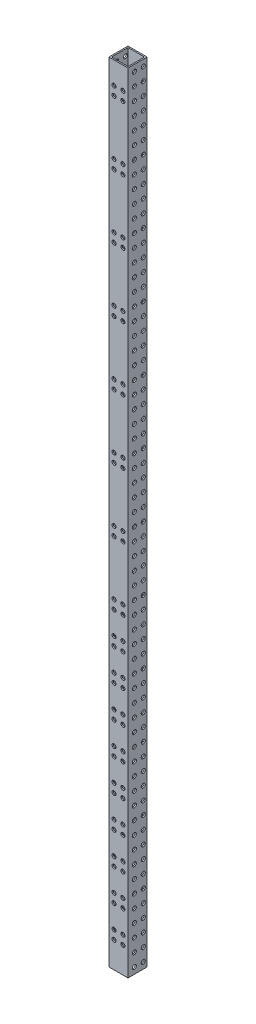
from build123d import *

# Parameters (mm, degrees)
SKETCH_1_W          = 15
SKETCH_1_H          = 15
SKETCH_1_W_2        = 13
SKETCH_1_H_2        = 13
EXTRUDE_1_DEPTH     = 620
SKETCH_3_R          = 1.6
CUT_EXTRUDE_1_DEPTH = 15
SKETCH_4_R          = 1.6
CUT_EXTRUDE_2_DEPTH = 15


with BuildPart() as part:
    # 草图1 → 凸台-拉伸1 (new body)
    with BuildSketch(Plane(origin=(0, 0, 0), x_dir=(1, 0, 0), z_dir=(0, 1, 0))):
        Rectangle(SKETCH_1_W, SKETCH_1_H)
        Rectangle(SKETCH_1_W_2, SKETCH_1_H_2, mode=Mode.SUBTRACT)
    extrude(amount=EXTRUDE_1_DEPTH)

    # 草图3 → 切除-拉伸1 (cut)
    with BuildSketch(Plane.XY.offset(7.5)):
        with Locations((3.5, 245.5)):
            Circle(SKETCH_3_R)
        with Locations((-3.5, 245.5)):
            Circle(SKETCH_3_R)
        with Locations((-3.5, 252.5)):
            Circle(SKETCH_3_R)
        with Locations((3.5, 252.5)):
            Circle(SKETCH_3_R)
        with Locations((-3.5, 302.5)):
            Circle(SKETCH_3_R)
        with Locations((-3.5, 295.5)):
            Circle(SKETCH_3_R)
        with Locations((3.5, 295.5)):
            Circle(SKETCH_3_R)
        with Locations((3.5, 302.5)):
            Circle(SKETCH_3_R)
        with Locations((-3.5, 352.5)):
            Circle(SKETCH_3_R)
        with Locations((-3.5, 345.5)):
            Circle(SKETCH_3_R)
        with Locations((3.5, 345.5)):
            Circle(SKETCH_3_R)
        with Locations((3.5, 352.5)):
            Circle(SKETCH_3_R)
        with Locations((-3.5, 402.5)):
            Circle(SKETCH_3_R)
        with Locations((-3.5, 395.5)):
            Circle(SKETCH_3_R)
        with Locations((3.5, 395.5)):
            Circle(SKETCH_3_R)
        with Locations((3.5, 402.5)):
            Circle(SKETCH_3_R)
        with Locations((-3.5, 452.5)):
            Circle(SKETCH_3_R)
        with Locations((-3.5, 445.5)):
            Circle(SKETCH_3_R)
        with Locations((3.5, 445.5)):
            Circle(SKETCH_3_R)
        with Locations((3.5, 452.5)):
            Circle(SKETCH_3_R)
        with Locations((-3.5, 502.5)):
            Circle(SKETCH_3_R)
        with Locations((-3.5, 495.5)):
            Circle(SKETCH_3_R)
        with Locations((3.5, 495.5)):
            Circle(SKETCH_3_R)
        with Locations((3.5, 502.5)):
            Circle(SKETCH_3_R)
        with Locations((-3.5, 552.5)):
            Circle(SKETCH_3_R)
        with Locations((-3.5, 545.5)):
            Circle(SKETCH_3_R)
        with Locations((3.5, 545.5)):
            Circle(SKETCH_3_R)
        with Locations((3.5, 552.5)):
            Circle(SKETCH_3_R)
        with Locations((-3.5, 602.5)):
            Circle(SKETCH_3_R)
        with Locations((-3.5, 595.5)):
            Circle(SKETCH_3_R)
        with Locations((3.5, 595.5)):
            Circle(SKETCH_3_R)
        with Locations((3.5, 602.5)):
            Circle(SKETCH_3_R)
        with Locations((-3.5, 227.5)):
            Circle(SKETCH_3_R)
        with Locations((3.5, 227.5)):
            Circle(SKETCH_3_R)
        with Locations((-3.5, 220.5)):
            Circle(SKETCH_3_R)
        with Locations((3.5, 220.5)):
            Circle(SKETCH_3_R)
        with Locations((-3.5, 202.5)):
            Circle(SKETCH_3_R)
        with Locations((3.5, 202.5)):
            Circle(SKETCH_3_R)
        with Locations((-3.5, 195.5)):
            Circle(SKETCH_3_R)
        with Locations((3.5, 195.5)):
            Circle(SKETCH_3_R)
        with Locations((-3.5, 177.5)):
            Circle(SKETCH_3_R)
        with Locations((3.5, 177.5)):
            Circle(SKETCH_3_R)
        with Locations((-3.5, 170.5)):
            Circle(SKETCH_3_R)
        with Locations((3.5, 170.5)):
            Circle(SKETCH_3_R)
        with Locations((-3.5, 152.5)):
            Circle(SKETCH_3_R)
        with Locations((3.5, 152.5)):
            Circle(SKETCH_3_R)
        with Locations((-3.5, 145.5)):
            Circle(SKETCH_3_R)
        with Locations((3.5, 145.5)):
            Circle(SKETCH_3_R)
        with Locations((-3.5, 127.5)):
            Circle(SKETCH_3_R)
        with Locations((3.5, 127.5)):
            Circle(SKETCH_3_R)
        with Locations((-3.5, 120.5)):
            Circle(SKETCH_3_R)
        with Locations((3.5, 120.5)):
            Circle(SKETCH_3_R)
        with Locations((-3.5, 102.5)):
            Circle(SKETCH_3_R)
        with Locations((3.5, 102.5)):
            Circle(SKETCH_3_R)
        with Locations((-3.5, 95.5)):
            Circle(SKETCH_3_R)
        with Locations((3.5, 95.5)):
            Circle(SKETCH_3_R)
        with Locations((-3.5, 77.5)):
            Circle(SKETCH_3_R)
        with Locations((3.5, 77.5)):
            Circle(SKETCH_3_R)
        with Locations((-3.5, 70.5)):
            Circle(SKETCH_3_R)
        with Locations((3.5, 70.5)):
            Circle(SKETCH_3_R)
        with Locations((-3.5, 52.5)):
            Circle(SKETCH_3_R)
        with Locations((3.5, 52.5)):
            Circle(SKETCH_3_R)
        with Locations((-3.5, 45.5)):
            Circle(SKETCH_3_R)
        with Locations((3.5, 45.5)):
            Circle(SKETCH_3_R)
        with Locations((-3.5, 27.5)):
            Circle(SKETCH_3_R)
        with Locations((3.5, 27.5)):
            Circle(SKETCH_3_R)
        with Locations((-3.5, 20.5)):
            Circle(SKETCH_3_R)
        with Locations((3.5, 20.5)):
            Circle(SKETCH_3_R)
    extrude(amount=-CUT_EXTRUDE_1_DEPTH, mode=Mode.SUBTRACT)

    # 草图4 → 切除-拉伸2 (cut)
    with BuildSketch(Plane.ZY.offset(7.5)):
        with Locations((2.5, 5)):
            Circle(SKETCH_4_R)
        with Locations((-4.5, 5)):
            Circle(SKETCH_4_R)
        with Locations((-4.5, 15)):
            Circle(SKETCH_4_R)
        with Locations((2.5, 15)):
            Circle(SKETCH_4_R)
        with Locations((-4.5, 25)):
            Circle(SKETCH_4_R)
        with Locations((2.5, 25)):
            Circle(SKETCH_4_R)
        with Locations((-4.5, 35)):
            Circle(SKETCH_4_R)
        with Locations((2.5, 35)):
            Circle(SKETCH_4_R)
        with Locations((-4.5, 45)):
            Circle(SKETCH_4_R)
        with Locations((2.5, 45)):
            Circle(SKETCH_4_R)
        with Locations((-4.5, 55)):
            Circle(SKETCH_4_R)
        with Locations((2.5, 55)):
            Circle(SKETCH_4_R)
        with Locations((-4.5, 65)):
            Circle(SKETCH_4_R)
        with Locations((2.5, 65)):
            Circle(SKETCH_4_R)
        with Locations((-4.5, 75)):
            Circle(SKETCH_4_R)
        with Locations((2.5, 75)):
            Circle(SKETCH_4_R)
        with Locations((-4.5, 85)):
            Circle(SKETCH_4_R)
        with Locations((2.5, 85)):
            Circle(SKETCH_4_R)
        with Locations((-4.5, 95)):
            Circle(SKETCH_4_R)
        with Locations((2.5, 95)):
            Circle(SKETCH_4_R)
        with Locations((-4.5, 105)):
            Circle(SKETCH_4_R)
        with Locations((2.5, 105)):
            Circle(SKETCH_4_R)
        with Locations((-4.5, 115)):
            Circle(SKETCH_4_R)
        with Locations((2.5, 115)):
            Circle(SKETCH_4_R)
        with Locations((-4.5, 125)):
            Circle(SKETCH_4_R)
        with Locations((2.5, 125)):
            Circle(SKETCH_4_R)
        with Locations((-4.5, 135)):
            Circle(SKETCH_4_R)
        with Locations((2.5, 135)):
            Circle(SKETCH_4_R)
        with Locations((-4.5, 145)):
            Circle(SKETCH_4_R)
        with Locations((2.5, 145)):
            Circle(SKETCH_4_R)
        with Locations((-4.5, 155)):
            Circle(SKETCH_4_R)
        with Locations((2.5, 155)):
            Circle(SKETCH_4_R)
        with Locations((-4.5, 165)):
            Circle(SKETCH_4_R)
        with Locations((2.5, 165)):
            Circle(SKETCH_4_R)
        with Locations((-4.5, 175)):
            Circle(SKETCH_4_R)
        with Locations((2.5, 175)):
            Circle(SKETCH_4_R)
        with Locations((-4.5, 185)):
            Circle(SKETCH_4_R)
        with Locations((2.5, 185)):
            Circle(SKETCH_4_R)
        with Locations((-4.5, 195)):
            Circle(SKETCH_4_R)
        with Locations((2.5, 195)):
            Circle(SKETCH_4_R)
        with Locations((-4.5, 205)):
            Circle(SKETCH_4_R)
        with Locations((2.5, 205)):
            Circle(SKETCH_4_R)
        with Locations((-4.5, 215)):
            Circle(SKETCH_4_R)
        with Locations((2.5, 215)):
            Circle(SKETCH_4_R)
        with Locations((-4.5, 225)):
            Circle(SKETCH_4_R)
        with Locations((2.5, 225)):
            Circle(SKETCH_4_R)
        with Locations((-4.5, 235)):
            Circle(SKETCH_4_R)
        with Locations((2.5, 235)):
            Circle(SKETCH_4_R)
        with Locations((-4.5, 245)):
            Circle(SKETCH_4_R)
        with Locations((2.5, 245)):
            Circle(SKETCH_4_R)
        with Locations((-4.5, 255)):
            Circle(SKETCH_4_R)
        with Locations((2.5, 255)):
            Circle(SKETCH_4_R)
        with Locations((-4.5, 265)):
            Circle(SKETCH_4_R)
        with Locations((2.5, 265)):
            Circle(SKETCH_4_R)
        with Locations((-4.5, 275)):
            Circle(SKETCH_4_R)
        with Locations((2.5, 275)):
            Circle(SKETCH_4_R)
        with Locations((-4.5, 285)):
            Circle(SKETCH_4_R)
        with Locations((2.5, 285)):
            Circle(SKETCH_4_R)
        with Locations((-4.5, 295)):
            Circle(SKETCH_4_R)
        with Locations((2.5, 295)):
            Circle(SKETCH_4_R)
        with Locations((-4.5, 305)):
            Circle(SKETCH_4_R)
        with Locations((2.5, 305)):
            Circle(SKETCH_4_R)
        with Locations((-4.5, 315)):
            Circle(SKETCH_4_R)
        with Locations((2.5, 315)):
            Circle(SKETCH_4_R)
        with Locations((-4.5, 325)):
            Circle(SKETCH_4_R)
        with Locations((2.5, 325)):
            Circle(SKETCH_4_R)
        with Locations((-4.5, 335)):
            Circle(SKETCH_4_R)
        with Locations((2.5, 335)):
            Circle(SKETCH_4_R)
        with Locations((-4.5, 345)):
            Circle(SKETCH_4_R)
        with Locations((2.5, 345)):
            Circle(SKETCH_4_R)
        with Locations((-4.5, 355)):
            Circle(SKETCH_4_R)
        with Locations((2.5, 355)):
            Circle(SKETCH_4_R)
        with Locations((-4.5, 365)):
            Circle(SKETCH_4_R)
        with Locations((2.5, 365)):
            Circle(SKETCH_4_R)
        with Locations((-4.5, 375)):
            Circle(SKETCH_4_R)
        with Locations((2.5, 375)):
            Circle(SKETCH_4_R)
        with Locations((-4.5, 385)):
            Circle(SKETCH_4_R)
        with Locations((2.5, 385)):
            Circle(SKETCH_4_R)
        with Locations((-4.5, 395)):
            Circle(SKETCH_4_R)
        with Locations((2.5, 395)):
            Circle(SKETCH_4_R)
        with Locations((-4.5, 405)):
            Circle(SKETCH_4_R)
        with Locations((2.5, 405)):
            Circle(SKETCH_4_R)
        with Locations((-4.5, 415)):
            Circle(SKETCH_4_R)
        with Locations((2.5, 415)):
            Circle(SKETCH_4_R)
        with Locations((-4.5, 425)):
            Circle(SKETCH_4_R)
        with Locations((2.5, 425)):
            Circle(SKETCH_4_R)
        with Locations((-4.5, 435)):
            Circle(SKETCH_4_R)
        with Locations((2.5, 435)):
            Circle(SKETCH_4_R)
        with Locations((-4.5, 445)):
            Circle(SKETCH_4_R)
        with Locations((2.5, 445)):
            Circle(SKETCH_4_R)
        with Locations((-4.5, 455)):
            Circle(SKETCH_4_R)
        with Locations((2.5, 455)):
            Circle(SKETCH_4_R)
        with Locations((-4.5, 465)):
            Circle(SKETCH_4_R)
        with Locations((2.5, 465)):
            Circle(SKETCH_4_R)
        with Locations((-4.5, 475)):
            Circle(SKETCH_4_R)
        with Locations((2.5, 475)):
            Circle(SKETCH_4_R)
        with Locations((-4.5, 485)):
            Circle(SKETCH_4_R)
        with Locations((2.5, 485)):
            Circle(SKETCH_4_R)
        with Locations((-4.5, 495)):
            Circle(SKETCH_4_R)
        with Locations((2.5, 495)):
            Circle(SKETCH_4_R)
        with Locations((-4.5, 505)):
            Circle(SKETCH_4_R)
        with Locations((2.5, 505)):
            Circle(SKETCH_4_R)
        with Locations((-4.5, 515)):
            Circle(SKETCH_4_R)
        with Locations((2.5, 515)):
            Circle(SKETCH_4_R)
        with Locations((-4.5, 525)):
            Circle(SKETCH_4_R)
        with Locations((2.5, 525)):
            Circle(SKETCH_4_R)
        with Locations((-4.5, 535)):
            Circle(SKETCH_4_R)
        with Locations((2.5, 535)):
            Circle(SKETCH_4_R)
        with Locations((-4.5, 545)):
            Circle(SKETCH_4_R)
        with Locations((2.5, 545)):
            Circle(SKETCH_4_R)
        with Locations((-4.5, 555)):
            Circle(SKETCH_4_R)
        with Locations((2.5, 555)):
            Circle(SKETCH_4_R)
        with Locations((-4.5, 565)):
            Circle(SKETCH_4_R)
        with Locations((2.5, 565)):
            Circle(SKETCH_4_R)
        with Locations((-4.5, 575)):
            Circle(SKETCH_4_R)
        with Locations((2.5, 575)):
            Circle(SKETCH_4_R)
        with Locations((-4.5, 585)):
            Circle(SKETCH_4_R)
        with Locations((2.5, 585)):
            Circle(SKETCH_4_R)
        with Locations((-4.5, 595)):
            Circle(SKETCH_4_R)
        with Locations((2.5, 595)):
            Circle(SKETCH_4_R)
        with Locations((-4.5, 605)):
            Circle(SKETCH_4_R)
        with Locations((2.5, 605)):
            Circle(SKETCH_4_R)
        with Locations((-4.5, 615)):
            Circle(SKETCH_4_R)
        with Locations((2.5, 615)):
            Circle(SKETCH_4_R)
    extrude(amount=-CUT_EXTRUDE_2_DEPTH, mode=Mode.SUBTRACT)


solid = part.part
